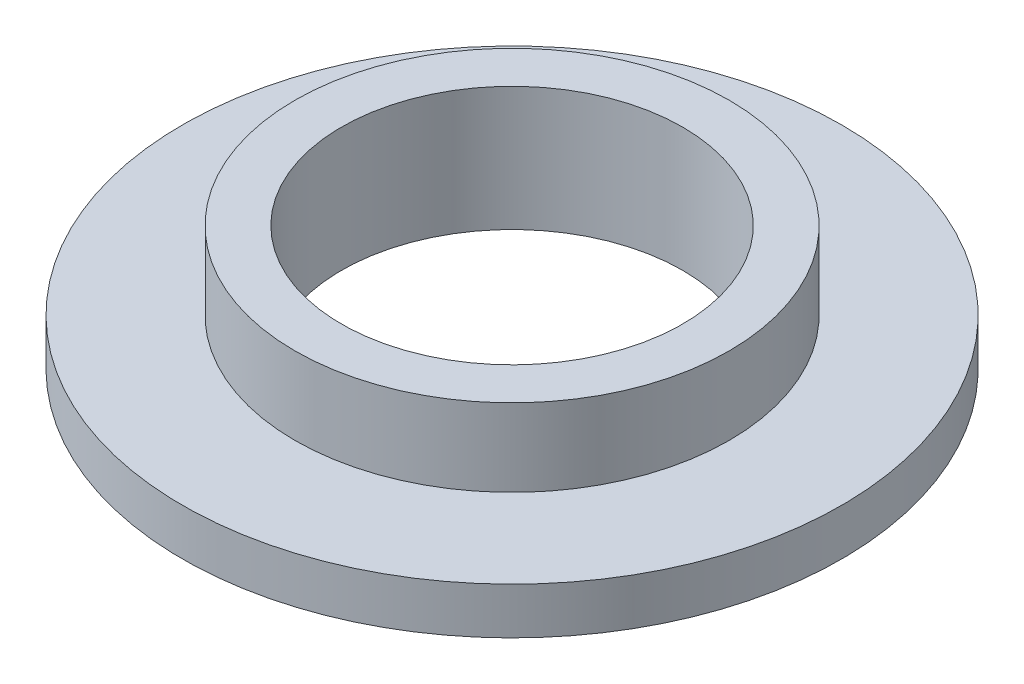
from build123d import *


with BuildPart() as part:
    # Sketch1 → Revolve1 (revolve)
    with BuildSketch(Plane.XY, mode=Mode.PRIVATE) as revolve1_sk:
        Polygon((-2.794, 0), (-2.794, 2.032), (-3.556, 2.032), (-3.556, 0.762), (-5.3975, 0.762), (-5.3975, 0), align=None)
    revolve(revolve1_sk.sketch.rotate(Axis((0, 0, 0), (0, 1, 0)), 270), axis=Axis((0, 0, 0), (0, 1, 0)))


solid = part.part
